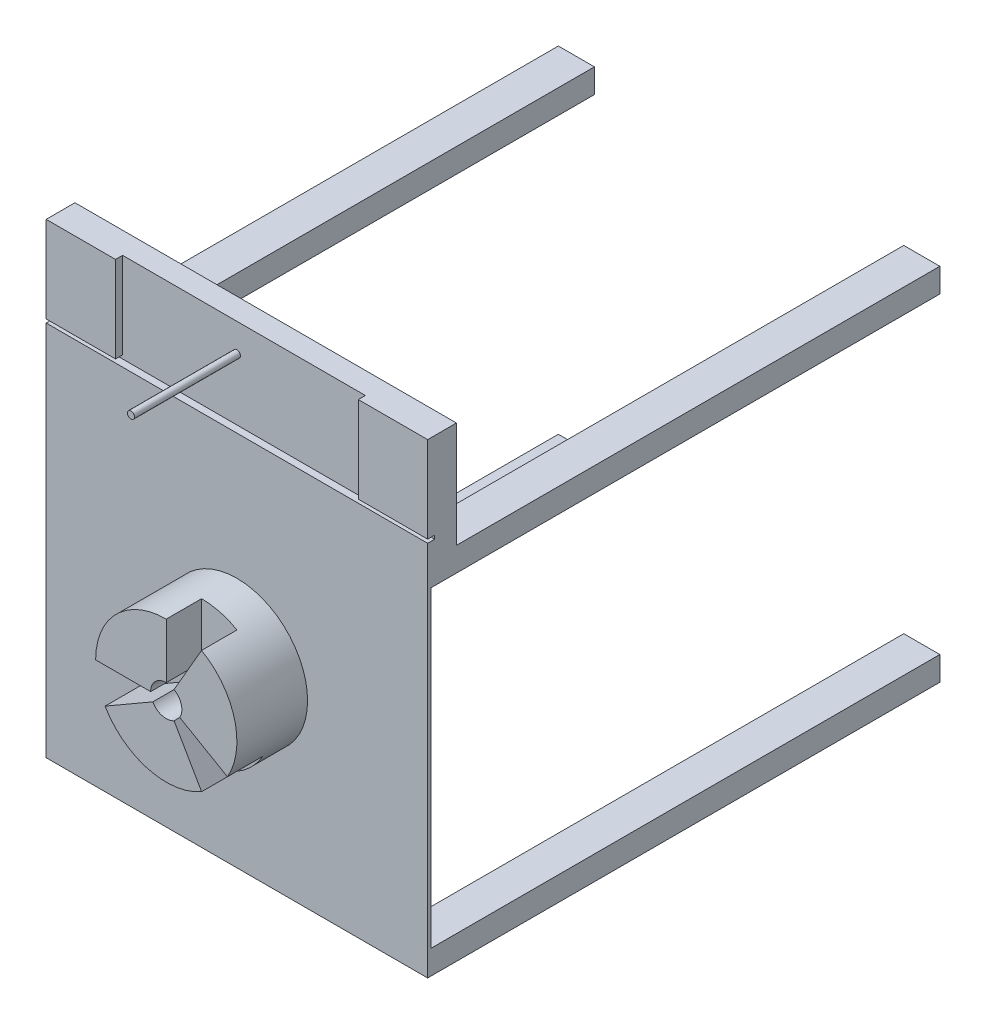
from build123d import *

# Parameters (mm, degrees)
SKETCH1_W           = 540
SKETCH1_H           = 510
BOSS_EXTRUDE1_DEPTH = 5
SKETCH2_W           = 51.059777949
SKETCH2_H           = 34.055748457
BOSS_EXTRUDE2_DEPTH = 720
SKETCH3_R           = 100
BOSS_EXTRUDE3_DEPTH = 100
SKETCH4_W           = 540
SKETCH4_H           = 40.743294896
BOSS_EXTRUDE4_DEPTH = 150
SKETCH5_R           = 5
BOSS_EXTRUDE5_DEPTH = 150
CUT_EXTRUDE1_DEPTH  = 10
CUT_EXTRUDE2_DEPTH  = 50


with BuildPart() as part:
    # Sketch1 → Boss-Extrude1 (new body)
    with BuildSketch(Plane.XY):
        Rectangle(SKETCH1_W, SKETCH1_H)
    extrude(amount=BOSS_EXTRUDE1_DEPTH)

    # Sketch2 → Boss-Extrude2 (add)
    with BuildSketch(Plane(origin=(0, 0, 0), x_dir=(-1, 0, 0), z_dir=(0, 0, -1))):
        with Locations((244.470111025, 237.972125772)):
            Rectangle(SKETCH2_W, SKETCH2_H)
        with Locations((-244.470111025, 237.972125772)):
            Rectangle(SKETCH2_W, SKETCH2_H)
        with Locations((244.470111025, -237.972125772)):
            Rectangle(SKETCH2_W, SKETCH2_H)
        with Locations((-244.470111025, -237.972125772)):
            Rectangle(SKETCH2_W, SKETCH2_H)
    extrude(amount=BOSS_EXTRUDE2_DEPTH)

    # Sketch3 → Boss-Extrude3 (add)
    with BuildSketch(Plane.XY.offset(5)):
        Circle(SKETCH3_R)
    extrude(amount=BOSS_EXTRUDE3_DEPTH)

    # Sketch4 → Boss-Extrude4 (add)
    with BuildSketch(Plane(origin=(0, 255, 0), x_dir=(1, 0, 0), z_dir=(0, 1, 0))):
        with Locations((0, 15.371647448)):
            Rectangle(SKETCH4_W, SKETCH4_H)
    extrude(amount=BOSS_EXTRUDE4_DEPTH)

    # Sketch5 → Boss-Extrude5 (add)
    with BuildSketch(Plane.XY.offset(5)):
        with Locations((0, 375.191829561)):
            Circle(SKETCH5_R)
    extrude(amount=BOSS_EXTRUDE5_DEPTH)

    # Sketch6 → Cut-Extrude1 (cut)
    with BuildSketch(Plane.XY.offset(5)):
        Polygon((-171.816057956, 405), (-171.816057956, 282.937457133), (-270, 282.937457133), (-270, 277.937457133), (270, 277.937457133), (270, 282.937457133), (171.816057956, 282.937457133), (171.816057956, 405), align=None)
    extrude(amount=-CUT_EXTRUDE1_DEPTH, mode=Mode.SUBTRACT)


with BuildPart() as cut_extrude1_piece_1:
    # of the separate pieces the step leaves, piece 1, a body of its own (cut_extrude1_pieces)
    add(part.part.solids().sort_by_distance((270, -255, 5))[0])

    # Sketch7 → Cut-Extrude2 (cut)
    with BuildSketch(Plane.XY.offset(105)):
        with BuildLine():
            Line((0, 100), (0, 22.102227925))
            ThreePointArc((0, 22.102227925), (-15.628635245, 15.628635245), (-22.102227925, 0))
            Line((-22.102227925, 0), (-100, 0))
            ThreePointArc((-100, 0), (-96.592582629, -25.88190451), (-86.602540378, -50))
            Line((-86.602540378, -50), (-19.141090864, -11.051113963))
            ThreePointArc((-19.141090864, -11.051113963), (-5.720477526, -21.349112772), (11.051113963, -19.141090864))
            Line((11.051113963, -19.141090864), (50, -86.602540378))
            ThreePointArc((50, -86.602540378), (70.710678119, -70.710678119), (86.602540378, -50))
            Line((86.602540378, -50), (19.141090864, -11.051113963))
            ThreePointArc((19.141090864, -11.051113963), (21.349112772, 5.720477526), (11.051113963, 19.141090864))
            Line((11.051113963, 19.141090864), (50, 86.602540378))
            ThreePointArc((50, 86.602540378), (25.88190451, 96.592582629), (0, 100))
        make_face()
    extrude(amount=-CUT_EXTRUDE2_DEPTH, mode=Mode.SUBTRACT)


with BuildPart() as cut_extrude1_piece_2:
    # of the separate pieces the step leaves, piece 2, a body of its own (cut_extrude1_pieces)
    add(part.part.solids().sort_by_distance((5, 375.191829561, 5))[0])


solid = Compound([cut_extrude1_piece_1.part, cut_extrude1_piece_2.part])
